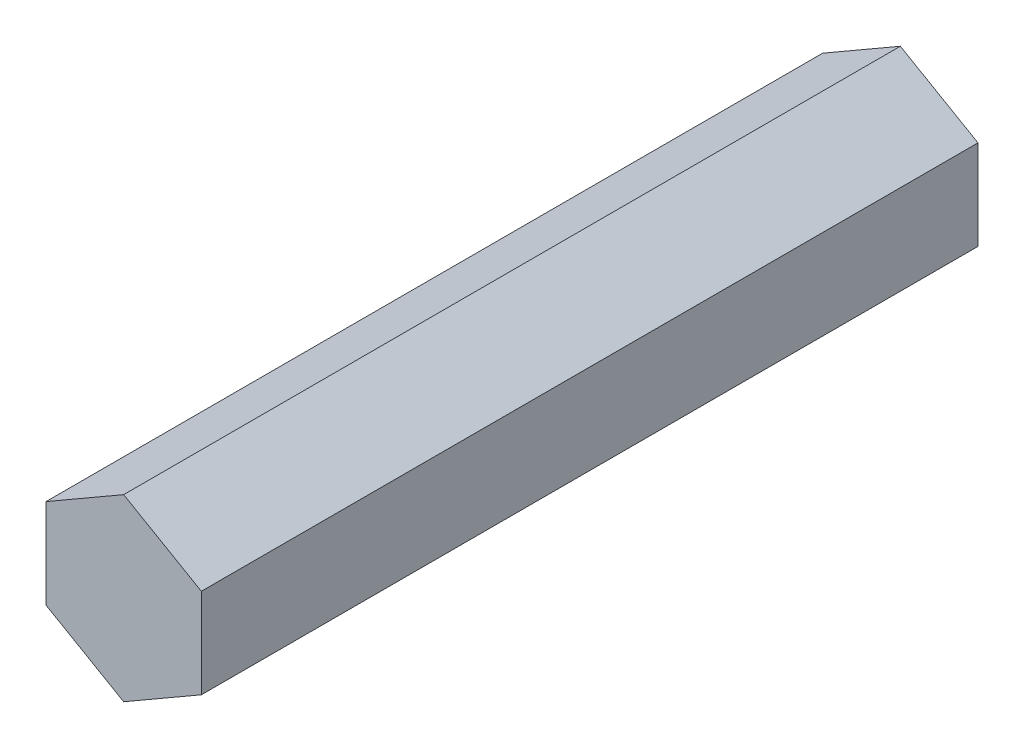
from build123d import *

# Parameters (mm, degrees)
BOSS_EXTRUDE1_DEPTH = 63.5


with BuildPart() as part:
    # Sketch1 → Boss-Extrude1 (new body)
    with BuildSketch(Plane.XY):
        Polygon((-6.35, 3.666174209), (-6.35, -3.666174209), (0, -7.332348419), (6.35, -3.666174209), (6.35, 3.666174209), (0, 7.332348419), align=None)
    extrude(amount=BOSS_EXTRUDE1_DEPTH)


solid = part.part
